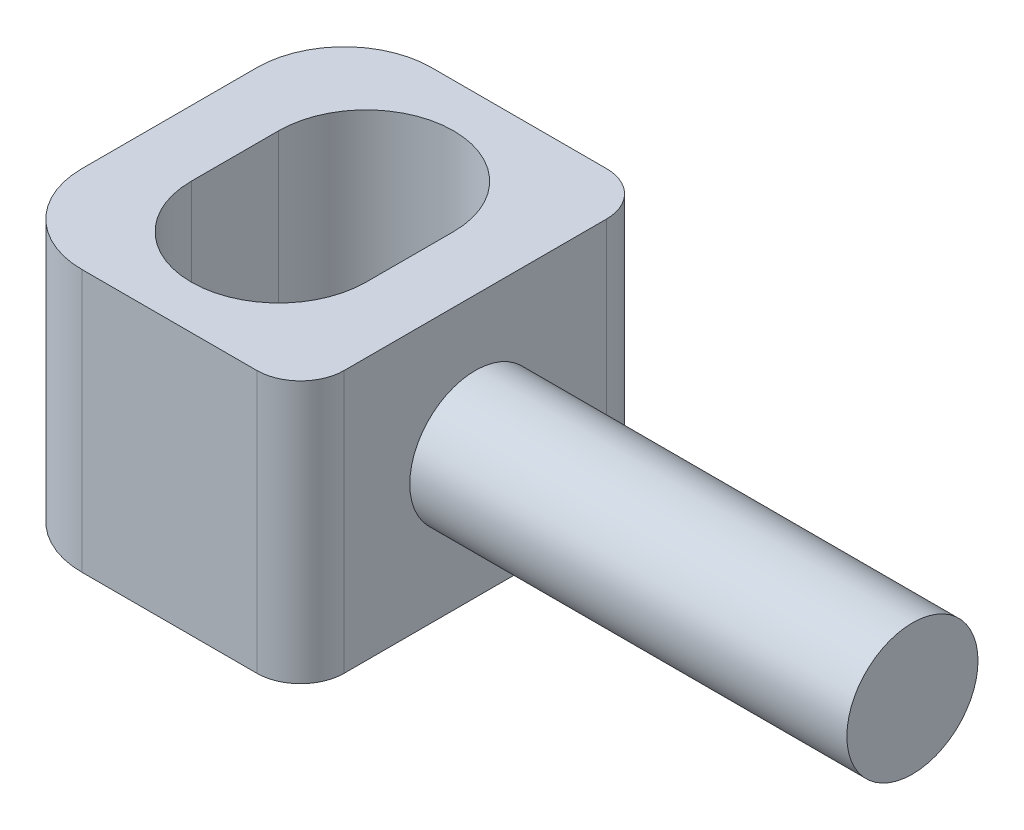
from build123d import *

# Parameters (mm, degrees)
BOSS_EXTRUDE1_DEPTH = 30
SKETCH2_R           = 7.5
BOSS_EXTRUDE2_DEPTH = 50


with BuildPart() as part:
    # Sketch1 → Boss-Extrude1 (new body)
    with BuildSketch(Plane(origin=(0, 0, 0), x_dir=(1, 0, 0), z_dir=(0, 1, 0))):
        with BuildLine():
            Line((-10, 20), (10, 20))
            ThreePointArc((10, 20), (13.535533906, 18.535533906), (15, 15))
            Line((15, 15), (15, -15))
            ThreePointArc((15, -15), (13.535533906, -18.535533906), (10, -20))
            Line((10, -20), (-10, -20))
            ThreePointArc((-10, -20), (-17.071067812, -17.071067812), (-20, -10))
            Line((-20, -10), (-20, 10))
            ThreePointArc((-20, 10), (-17.071067812, 17.071067812), (-10, 20))
        make_face()
        with BuildLine():
            Line((-12.5, 5), (-12.5, -5))
            ThreePointArc((-12.5, -5), (-2.5, -15), (7.5, -5))
            Line((7.5, -5), (7.5, 5))
            ThreePointArc((7.5, 5), (-2.5, 15), (-12.5, 5))
        make_face(mode=Mode.SUBTRACT)
    extrude(amount=BOSS_EXTRUDE1_DEPTH)

    # Sketch2 → Boss-Extrude2 (add)
    with BuildSketch(Plane(origin=(15, 0, 0), x_dir=(0, 0, -1), z_dir=(1, 0, 0))):
        with Locations(Location((0, 15, 0), (0, 0, 180))):
            Circle(SKETCH2_R)
    extrude(amount=BOSS_EXTRUDE2_DEPTH)


solid = part.part
